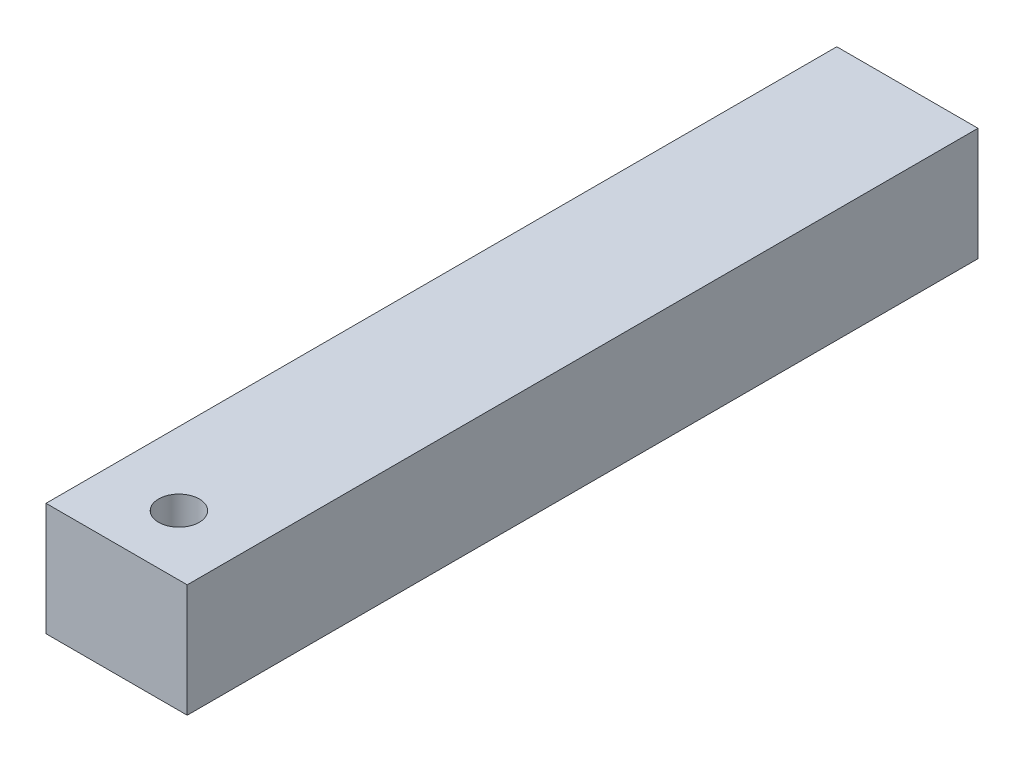
from build123d import *

# Parameters (mm, degrees)
SKETCH1_W           = 31.75
SKETCH1_H           = 177.8
BOSS_EXTRUDE1_DEPTH = 25.4
SKETCH2_R           = 4.568621672
CUT_EXTRUDE1_DEPTH  = 25.4


with BuildPart() as part:
    # Sketch1 → Boss-Extrude1 (new body)
    with BuildSketch(Plane(origin=(0, 0, 0), x_dir=(1, 0, 0), z_dir=(0, 1, 0))):
        with Locations((15.875, -88.9)):
            Rectangle(SKETCH1_W, SKETCH1_H)
    extrude(amount=BOSS_EXTRUDE1_DEPTH)

    # Sketch2 → Cut-Extrude1 (cut)
    with BuildSketch(Plane(origin=(0, 25.4, 0), x_dir=(1, 0, 0), z_dir=(0, 1, 0))):
        with Locations(Location((16.371790065, -164.287892401, 0), (0, 0, 270))):
            Circle(SKETCH2_R)
    extrude(amount=-CUT_EXTRUDE1_DEPTH, mode=Mode.SUBTRACT)


solid = part.part
